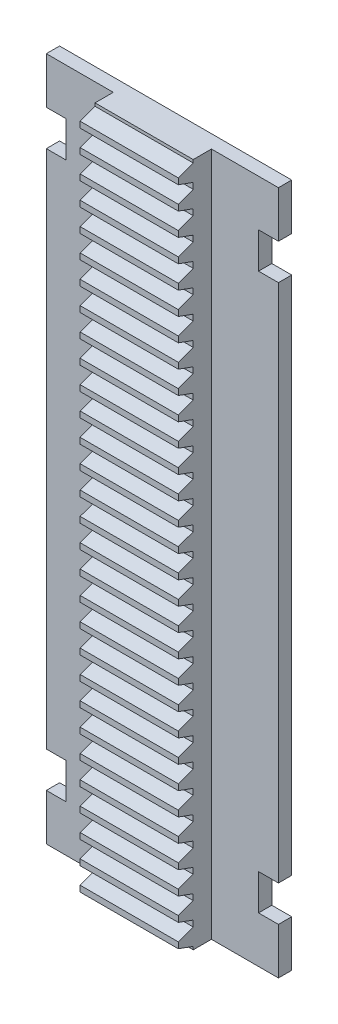
from build123d import *

# Parameters (mm, degrees)
SKETCH7_W           = 14.8
SKETCH7_H           = 103.2
BOSS_EXTRUDE4_DEPTH = 7
CUT_EXTRUDE2_DEPTH  = 15
LPATTERN1_COUNT     = 31
LPATTERN1_PITCH     = 3.44
SKETCH10_W          = 103.2
SKETCH10_H          = 2
BOSS_EXTRUDE5_DEPTH = 10.1
SKETCH11_W          = 103.2
SKETCH11_H          = 2
BOSS_EXTRUDE6_DEPTH = 10.1
SKETCH12_W          = 5.4
SKETCH12_H          = 5.4
CUT_EXTRUDE3_DEPTH  = 55.715719862


with BuildPart() as part:
    # Sketch7 → Boss-Extrude4 (new body)
    with BuildSketch(Plane.XY):
        Rectangle(SKETCH7_W, SKETCH7_H)
    extrude(amount=BOSS_EXTRUDE4_DEPTH)

    # Sketch9 → Cut-Extrude2 (cut)
    with BuildSketch(Plane.YZ.offset(7.4)):
        Polygon((-52.87, 7), (-52.051066973, 4.75), (-51.151066973, 4.75), (-50.332133946, 7), align=None)
    cut_extrude2 = extrude(amount=-CUT_EXTRUDE2_DEPTH, mode=Mode.SUBTRACT)

    # LPattern1: Cut-Extrude2 ×31
    with Locations(*[(0, i * LPATTERN1_PITCH, 0) for i in range(1, LPATTERN1_COUNT)]):
        add(cut_extrude2, mode=Mode.SUBTRACT)

    # Sketch10 → Boss-Extrude5 (add)
    with BuildSketch(Plane.YZ.offset(7.4)):
        with Locations((0, 1)):
            Rectangle(SKETCH10_W, SKETCH10_H)
    extrude(amount=BOSS_EXTRUDE5_DEPTH)

    # Sketch11 → Boss-Extrude6 (add)
    with BuildSketch(Plane(origin=(-7.4, 0, 0), x_dir=(0, -1, 0), z_dir=(-1, 0, 0))):
        with Locations((0, 1)):
            Rectangle(SKETCH11_W, SKETCH11_H)
    extrude(amount=BOSS_EXTRUDE6_DEPTH)

    # Sketch12 → Cut-Extrude3 (cut, through all)
    with BuildSketch(Plane.XY.offset(2)):
        with Locations((17.2, -41.9)):
            Rectangle(SKETCH12_W, SKETCH12_H)
        with Locations((17.2, 41.9)):
            Rectangle(SKETCH12_W, SKETCH12_H)
        with Locations((-17.2, 41.9)):
            Rectangle(SKETCH12_W, SKETCH12_H)
        with Locations((-17.2, -41.9)):
            Rectangle(SKETCH12_W, SKETCH12_H)
    extrude(amount=-CUT_EXTRUDE3_DEPTH, mode=Mode.SUBTRACT)


solid = part.part
